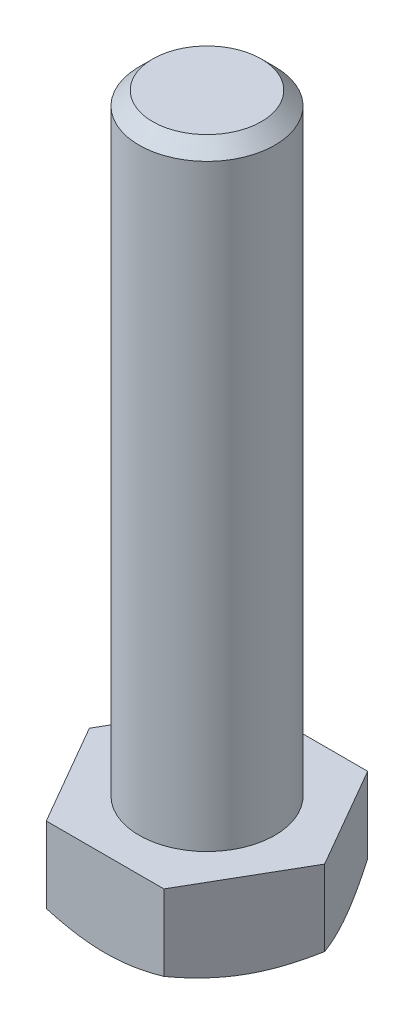
from build123d import *

# Parameters (mm, degrees)
EXTRUDE_1_DEPTH = 12.5
SKETCH_2_R      = 10
EXTRUDE_2_DEPTH = 90
CHAMFER_1_SIZE  = 2


with BuildPart() as part:
    # 草图1 → 凸台-拉伸1 (new body)
    with BuildSketch(Plane(origin=(0, 0, 0), x_dir=(1, 0, 0), z_dir=(0, 1, 0))):
        Polygon((8.660254038, -15), (17.320508076, 0), (8.660254038, 15), (-8.660254038, 15), (-17.320508076, 0), (-8.660254038, -15), align=None)
    extrude(amount=EXTRUDE_1_DEPTH)

    # 草图2 → 凸台-拉伸2 (add)
    with BuildSketch(Plane(origin=(0, 12.5, 0), x_dir=(1, 0, 0), z_dir=(0, 1, 0))):
        with Locations(Location((0, 0, 0), (0, 0, 90))):
            Circle(SKETCH_2_R)
    extrude(amount=EXTRUDE_2_DEPTH)

    # 倒角1
    chamfer_1_edges = [part.edges().sort_by_distance(p)[0] for p in [
        (0, 102.5, 10),
    ]]
    chamfer(chamfer_1_edges, length=CHAMFER_1_SIZE)

    # 草图3 → 切除-旋转3 (revolve, cut)
    with BuildSketch(Plane(origin=(8.660254038, 0, 0), x_dir=(1, 0, 0), z_dir=(0, 0, 1))):
        Polygon((-23.660254038, 0), (-25.980762114, 1.339745962), (-25.980762114, 0), align=None)
    revolve(axis=Axis((0, 0, 0), (0, 1, 0)), mode=Mode.SUBTRACT)


solid = part.part
